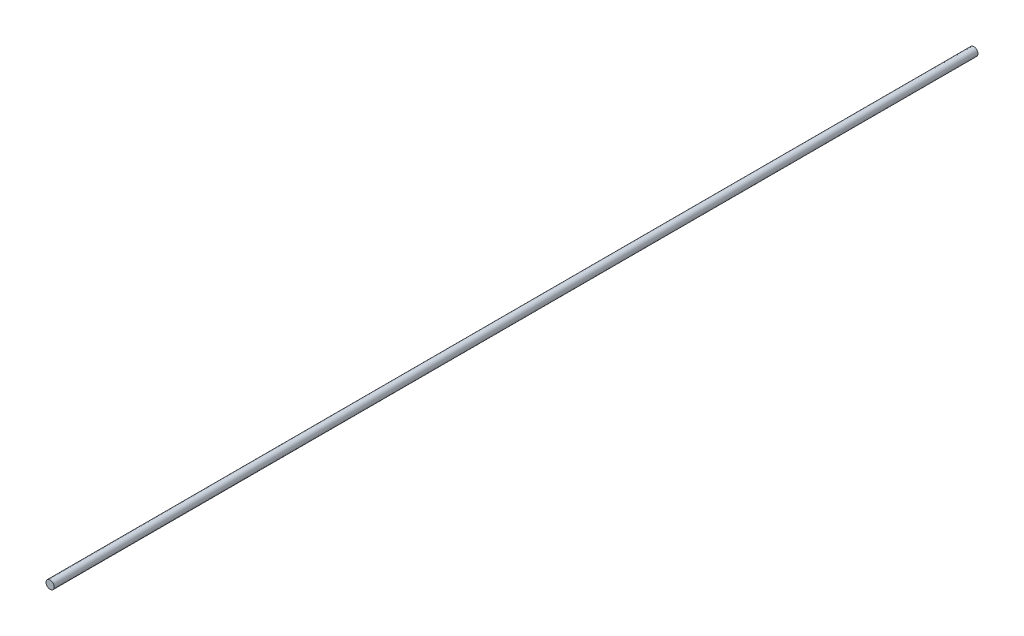
from build123d import *

# Parameters (mm, degrees)
SKETCH1_R           = 4
BOSS_EXTRUDE1_DEPTH = 900
CUT_EXTRUDE1_START  = -3.5
SKETCH2_W           = 5.340885048
SKETCH2_H           = 17.071757563
CUT_EXTRUDE1_DEPTH  = 10


with BuildPart() as part:
    # Sketch1 → Boss-Extrude1 (new body)
    with BuildSketch(Plane.XY):
        Circle(SKETCH1_R)
    extrude(amount=BOSS_EXTRUDE1_DEPTH)

    # Sketch2 → Cut-Extrude1 (cut)
    with BuildSketch(Plane(origin=(0, 0, 0), x_dir=(1, 0, 0), z_dir=(0, 1, 0)).offset(CUT_EXTRUDE1_START)):
        with Locations((-0.042815547, -101.994282838)):
            Rectangle(SKETCH2_W, SKETCH2_H)
        with Locations((-0.042815547, -11.994282838)):
            Rectangle(SKETCH2_W, SKETCH2_H)
        with Locations((-0.042815547, -191.994282838)):
            Rectangle(SKETCH2_W, SKETCH2_H)
        with Locations((-0.042815547, -281.994282838)):
            Rectangle(SKETCH2_W, SKETCH2_H)
        with Locations((-0.042815547, -371.994282838)):
            Rectangle(SKETCH2_W, SKETCH2_H)
        with Locations((-0.042815547, -461.994282838)):
            Rectangle(SKETCH2_W, SKETCH2_H)
        with Locations((-0.042815547, -551.994282838)):
            Rectangle(SKETCH2_W, SKETCH2_H)
        with Locations((-0.042815547, -641.994282838)):
            Rectangle(SKETCH2_W, SKETCH2_H)
        with Locations((-0.042815547, -731.994282838)):
            Rectangle(SKETCH2_W, SKETCH2_H)
        with Locations((-0.042815547, -821.994282838)):
            Rectangle(SKETCH2_W, SKETCH2_H)
    extrude(amount=-CUT_EXTRUDE1_DEPTH, mode=Mode.SUBTRACT)


solid = part.part
